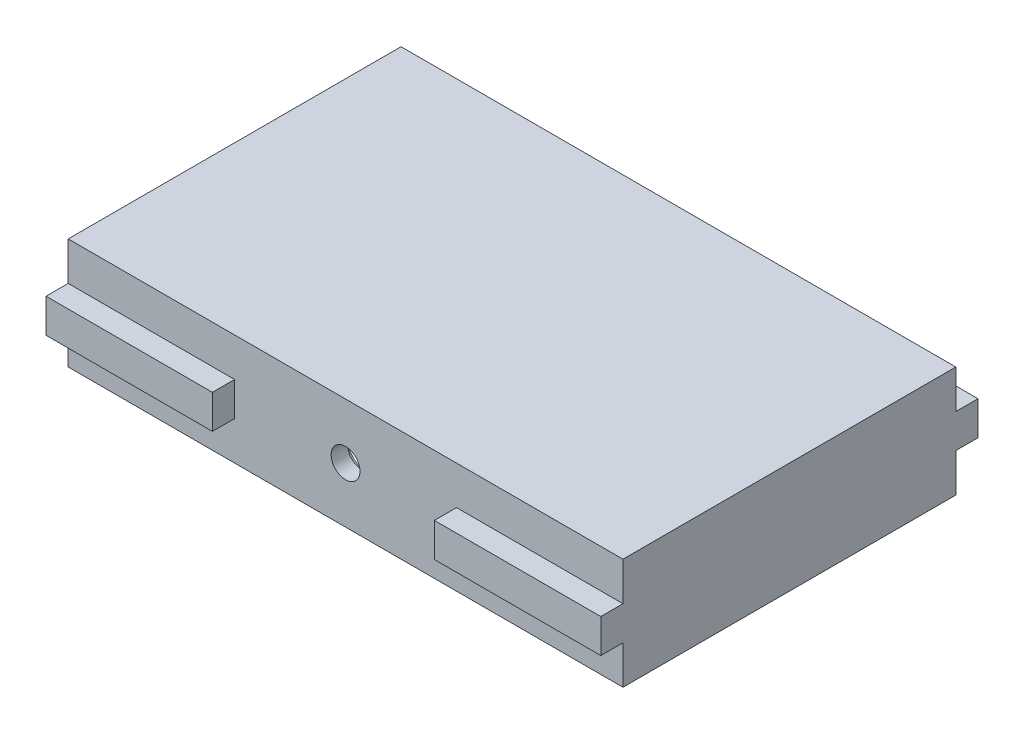
from build123d import *

# Parameters (mm, degrees)
SKETCH_1_W          = 100
SKETCH_1_H          = 60
EXTRUDE_1_DEPTH     = 20
SKETCH_2_W          = 90
SKETCH_2_H          = 50
CUT_EXTRUDE_1_DEPTH = 15
CUT_EXTRUDE_6_DEPTH = 200
SKETCH_9_R          = 5
CUT_EXTRUDE_7_DEPTH = 2
CUT_EXTRUDE_START   = -2
SKETCH_10_R         = 5
CUT_EXTRUDE_8_DEPTH = 2
SKETCH_11_W         = 30
SKETCH_11_H         = 3.05
EXTRUDE_2_DEPTH     = 4
SKETCH_12_W         = 30
SKETCH_12_H         = 3.05
EXTRUDE_3_DEPTH     = 4


with BuildPart() as part:
    # 草图1 → 凸台-拉伸1 (new body)
    with BuildSketch(Plane(origin=(0, 0, 0), x_dir=(1, 0, 0), z_dir=(0, 1, 0))):
        with Locations((29.550198358, -13.555421679)):
            Rectangle(SKETCH_1_W, SKETCH_1_H)
    extrude(amount=EXTRUDE_1_DEPTH)

    # 草图2 → 切除-拉伸1 (cut)
    with BuildSketch(Plane.XZ):
        with Locations((29.550198358, 13.555421679)):
            Rectangle(SKETCH_2_W, SKETCH_2_H)
    extrude(amount=-CUT_EXTRUDE_1_DEPTH, mode=Mode.SUBTRACT)

    # 草图8 → 切除-拉伸6 (cut)
    with BuildSketch(Plane.XY.offset(43.555421679)):
        with BuildLine():
            ThreePointArc((32.150198358, 10), (31.388675989, 11.838477631), (29.550198358, 12.6))
            Line((29.550198358, 12.6), (29.550198358, 7.4))
            ThreePointArc((29.550198358, 7.4), (31.388675989, 8.161522369), (32.150198358, 10))
        make_face()
        with BuildLine():
            Line((29.550198358, 7.4), (29.550198358, 12.6))
            ThreePointArc((29.550198358, 12.6), (26.950198358, 10), (29.550198358, 7.4))
        make_face()
    extrude(amount=-CUT_EXTRUDE_6_DEPTH, mode=Mode.SUBTRACT)

    # 草图9 → 切除-拉伸7 (cut)
    with BuildSketch(Plane.XY.offset(-11.444578321)):
        with Locations((29.550198358, 10)):
            Circle(SKETCH_9_R)
    extrude(amount=-CUT_EXTRUDE_7_DEPTH, mode=Mode.SUBTRACT)

    # 草图10 → 切除-拉伸8 (cut)
    with BuildSketch(Plane(origin=(0, 0, 38.555421679), x_dir=(-1, 0, 0), z_dir=(0, 0, -1)).offset(CUT_EXTRUDE_START)):
        with Locations(Location((-29.550198358, 10, 0), (0, 0, 180))):
            Circle(SKETCH_10_R)
    extrude(amount=CUT_EXTRUDE_8_DEPTH, mode=Mode.SUBTRACT)

    # 草图11 → 凸台-拉伸2 (add)
    with BuildSketch(Plane(origin=(0, 0, -16.444578321), x_dir=(-1, 0, 0), z_dir=(0, 0, -1))):
        with Locations((5.449801642, 8.475)):
            Rectangle(SKETCH_11_W, SKETCH_11_H)
        with Locations((5.449801642, 11.525)):
            Rectangle(SKETCH_11_W, SKETCH_11_H)
        with Locations((-64.550198358, 8.475)):
            Rectangle(SKETCH_11_W, SKETCH_11_H)
        with Locations((-64.550198358, 11.525)):
            Rectangle(SKETCH_11_W, SKETCH_11_H)
    extrude(amount=EXTRUDE_2_DEPTH)

    # 草图12 → 凸台-拉伸3 (add)
    with BuildSketch(Plane.XY.offset(43.555421679)):
        with Locations((-5.449801642, 11.525)):
            Rectangle(SKETCH_12_W, SKETCH_12_H)
        with Locations((-5.449801642, 8.475)):
            Rectangle(SKETCH_12_W, SKETCH_12_H)
        with Locations((64.550198358, 11.525)):
            Rectangle(SKETCH_12_W, SKETCH_12_H)
        with Locations((64.550198358, 8.475)):
            Rectangle(SKETCH_12_W, SKETCH_12_H)
    extrude(amount=EXTRUDE_3_DEPTH)


solid = part.part
